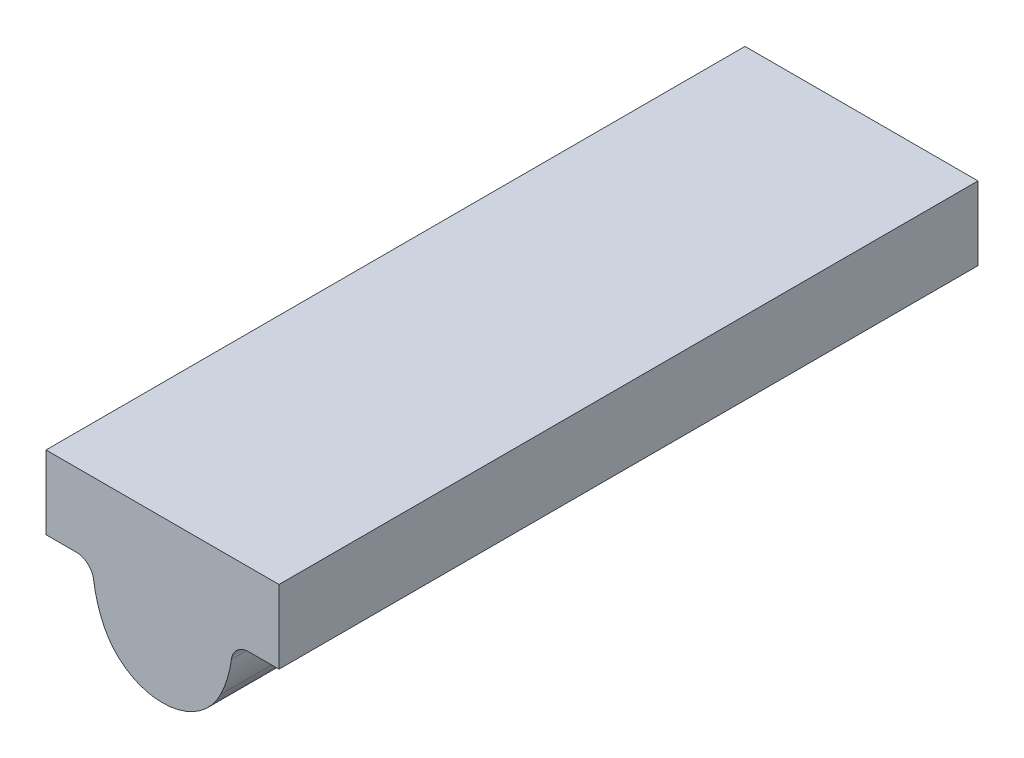
from build123d import *

# Parameters (mm, degrees)
ESTRUSIONE_ESTRUSIONE1_DEPTH = 3


with BuildPart() as part:
    # Schizzo1 → Estrusione-Estrusione1 (new, symmetric)
    with BuildSketch(Plane.XY):
        with BuildLine():
            Line((0.740175425, 0.75), (1, 0.75))
            Line((1, 0.75), (1, 1.38))
            Line((1, 1.38), (-1, 1.38))
            Line((-1, 1.38), (-1, 0.75))
            Line((-1, 0.75), (-0.740175425, 0.75))
            ThreePointArc((-0.740175425, 0.75), (-0.641268354, 0.712771412), (-0.591456891, 0.619565217))
            ThreePointArc((-0.591456891, 0.619565217), (-0.557611714, 0.461937846), (-0.498876404, 0.311797753))
            ThreePointArc((-0.498876404, 0.311797753), (0, 0), (0.498876404, 0.311797753))
            ThreePointArc((0.498876404, 0.311797753), (0.557611714, 0.461937846), (0.591456891, 0.619565217))
            ThreePointArc((0.591456891, 0.619565217), (0.641268354, 0.712771412), (0.740175425, 0.75))
        make_face()
    extrude(amount=ESTRUSIONE_ESTRUSIONE1_DEPTH, both=True)


solid = part.part
